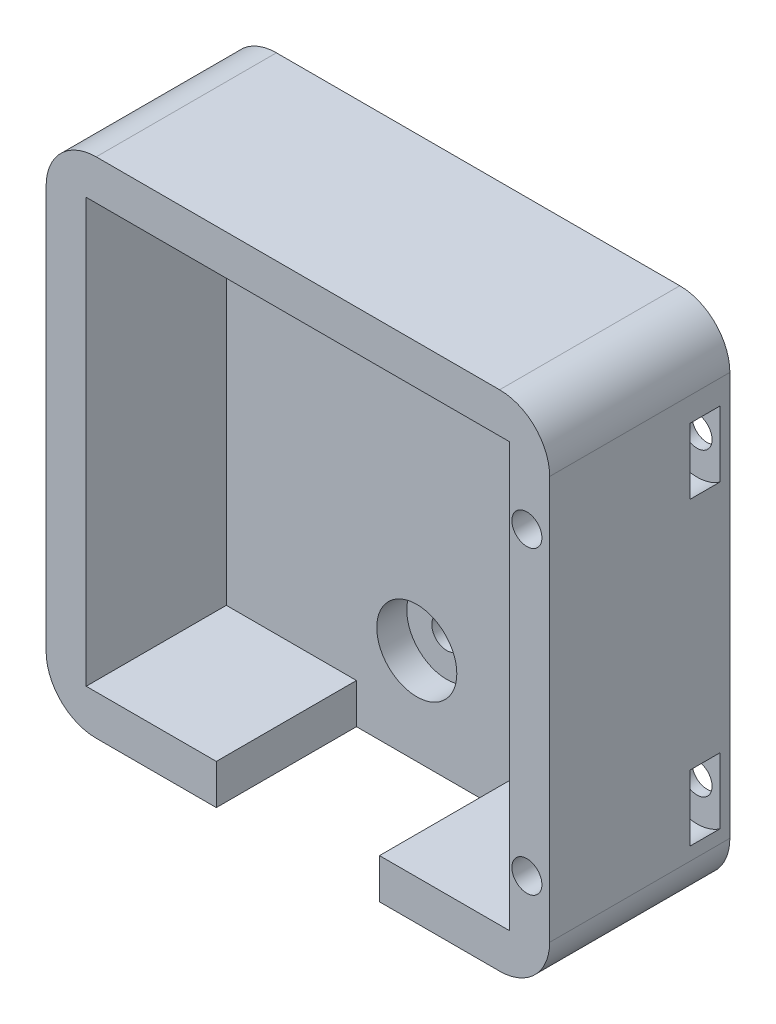
from build123d import *

# Parameters (mm, degrees)
ESQUISSE1_W             = 50.3
ESQUISSE1_H             = 50.3
BOSS_EXTRU_1_DEPTH      = 4
BOSS_EXTRU_2_DEPTH      = 14
ESQUISSE3_R             = 1.5
ENL_V_MAT_EXTRU_1_DEPTH = 74.376971864
CONG_2_R                = 5
ESQUISSE4_R             = 4
ENL_V_MAT_EXTRU_2_DEPTH = 3
CONG_6_R                = 5


with BuildPart() as part:
    # Esquisse1 → Boss.-Extru.1 (new body)
    with BuildSketch(Plane.XY):
        with Locations((25.15, 25.15)):
            Rectangle(ESQUISSE1_W, ESQUISSE1_H)
    extrude(amount=BOSS_EXTRU_1_DEPTH)

    # Esquisse2 → Boss.-Extru.2 (add)
    with BuildSketch(Plane.XY.offset(4)):
        Polygon((4, 46.3), (46.3, 46.3), (46.3, 4), (33.3, 4), (33.3, 0), (50.3, 0), (50.3, 50.3), (0, 50.3), (0, 0), (17, 0), (17, 4), (4, 4), align=None)
    extrude(amount=BOSS_EXTRU_2_DEPTH)

    # Esquisse3 → Enlèv. mat.-Extru.1 (cut, through all)
    with BuildSketch(Plane(origin=(0, 0, 0), x_dir=(-1, 0, 0), z_dir=(0, 0, -1))):
        with Locations((-23.024217253, 39.6)):
            Circle(ESQUISSE3_R)
        with Locations((-48.024217253, 39.6)):
            Circle(ESQUISSE3_R)
        with Locations((-48.024217253, 9.6)):
            Circle(ESQUISSE3_R)
        with Locations((-23.024217253, 9.6)):
            Circle(ESQUISSE3_R)
    extrude(amount=-ENL_V_MAT_EXTRU_1_DEPTH, mode=Mode.SUBTRACT)

    # Congé2
    cong_2_edges = [part.edges().sort_by_distance(p)[0] for p in [
        (0, 50.3, 9),
    ]]
    fillet(cong_2_edges, radius=CONG_2_R)

    # Esquisse4 → Enlèv. mat.-Extru.2 (cut)
    with BuildSketch(Plane.XY.offset(4)):
        with Locations((23.024217253, 39.6)):
            Circle(ESQUISSE4_R)
        with Locations((23.024217253, 9.6)):
            Circle(ESQUISSE4_R)
        with Locations((48.024217253, 39.6)):
            Circle(ESQUISSE4_R)
        with Locations((48.024217253, 9.6)):
            Circle(ESQUISSE4_R)
    extrude(amount=-ENL_V_MAT_EXTRU_2_DEPTH, mode=Mode.SUBTRACT)

    # Congé6
    cong_6_edges = [part.edges().sort_by_distance(p)[0] for p in [
        (50.3, 50.3, 9),
        (50.3, 0, 9),
        (0, 0, 9),
    ]]
    fillet(cong_6_edges, radius=CONG_6_R)


solid = part.part
